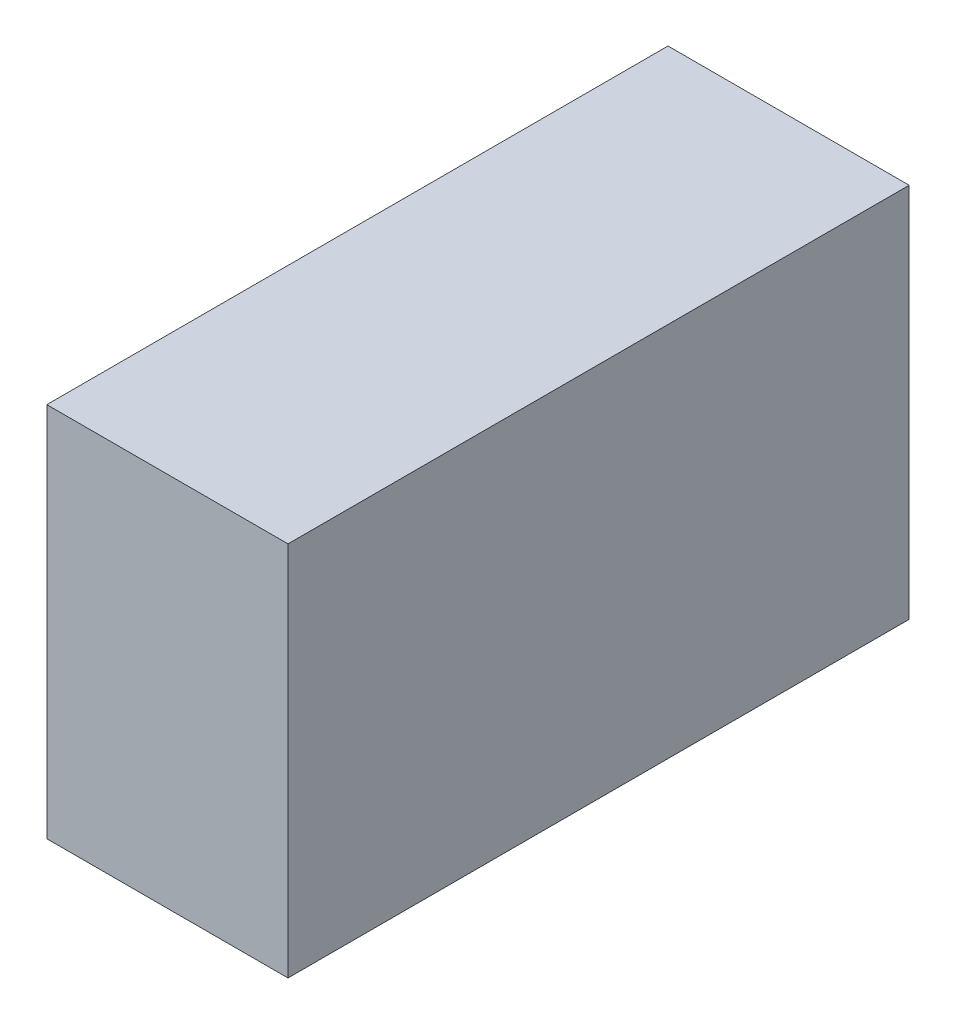
from build123d import *

# Parameters (mm, degrees)
BOSS_EXTRUDE1_DEPTH      = 0.175
BOSS_EXTRUDE1_DEPTH_BACK = 0.175
SKETCH3_W                = 0.22450602
SKETCH3_H                = 0.578260954


with BuildPart() as part:
    # Sketch3 → Boss-Extrude1 (new, two sides: drawn at the far end of the back side and taken through both)
    with BuildSketch(Plane(origin=(-13.833188261, -29.114916232, 26.767669777), x_dir=(1, 0, 0), z_dir=(0, 1, 0)).offset(-BOSS_EXTRUDE1_DEPTH_BACK)):
        with Locations((-0.072536362, -0.31657666)):
            Rectangle(SKETCH3_W, SKETCH3_H)
    extrude(amount=BOSS_EXTRUDE1_DEPTH + BOSS_EXTRUDE1_DEPTH_BACK)


solid = part.part
